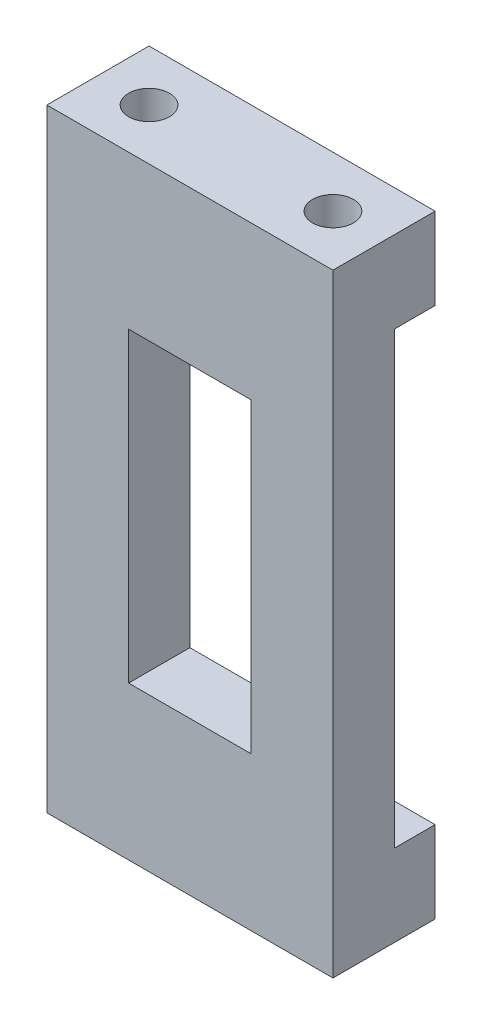
from build123d import *

# Parameters (mm, degrees)
SKETCH_1_W          = 28
SKETCH_1_H          = 60
SKETCH_1_W_2        = 12
SKETCH_1_H_2        = 30
EXTRUDE_1_DEPTH     = 3
SKETCH_3_W          = 4
SKETCH_3_H          = 8
EXTRUDE_2_DEPTH     = 14
SKETCH_2_R          = 2
CUT_EXTRUDE_1_DEPTH = 12


with BuildPart() as part:
    # 草图1 → 凸台-拉伸1 (new, symmetric)
    with BuildSketch(Plane.XY):
        Rectangle(SKETCH_1_W, SKETCH_1_H)
        Rectangle(SKETCH_1_W_2, SKETCH_1_H_2, mode=Mode.SUBTRACT)
    extrude(amount=EXTRUDE_1_DEPTH, both=True)

    # 草图3 → 凸台-拉伸2 (add, symmetric)
    with BuildSketch(Plane(origin=(0, 0, 0), x_dir=(0, 0, -1), z_dir=(1, 0, 0))):
        with Locations((5, -26)):
            Rectangle(SKETCH_3_W, SKETCH_3_H)
        with Locations((5, 26)):
            Rectangle(SKETCH_3_W, SKETCH_3_H)
    extrude(amount=EXTRUDE_2_DEPTH, both=True)

    # 草图2 → 切除-拉伸1 (cut)
    with BuildSketch(Plane(origin=(0, 30, 0), x_dir=(1, 0, 0), z_dir=(0, 1, 0))):
        with Locations(Location((-9, 2, 0), (0, 0, 270))):
            Circle(SKETCH_2_R)
        with Locations(Location((9, 2, 0), (0, 0, 270))):
            Circle(SKETCH_2_R)
    cut_extrude_1 = extrude(amount=-CUT_EXTRUDE_1_DEPTH, mode=Mode.SUBTRACT)

    # 镜向1: 切除-拉伸1 across plane
    add(cut_extrude_1.mirror(Plane.ZX), mode=Mode.SUBTRACT)


solid = part.part
